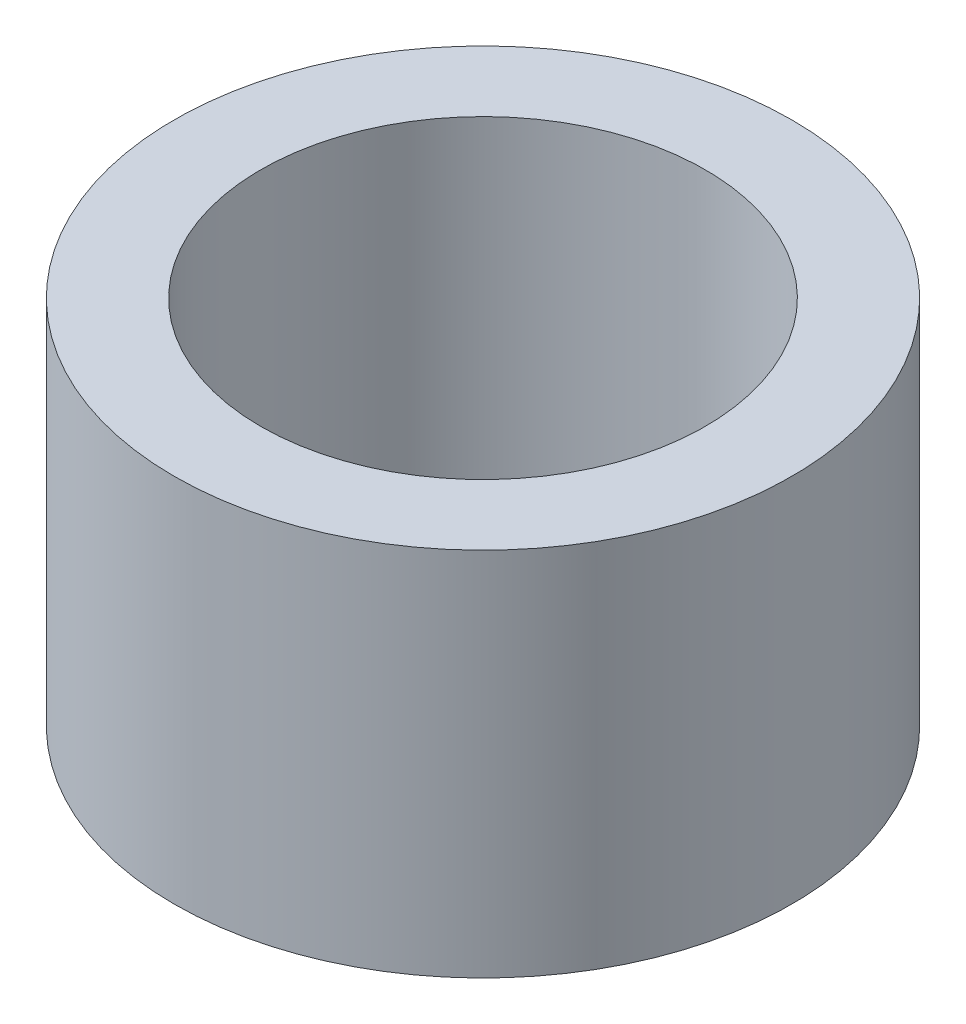
from build123d import *

# Parameters (mm, degrees)
SKETCH1_R           = 2.5
SKETCH1_R_2         = 1.8
BOSS_EXTRUDE1_DEPTH = 3


with BuildPart() as part:
    # Sketch1 → Boss-Extrude1 (new body)
    with BuildSketch(Plane(origin=(0, 0, 0), x_dir=(1, 0, 0), z_dir=(0, 1, 0))):
        with Locations(Location((0, 0, 0), (0, 0, 270))):
            Circle(SKETCH1_R)
        with Locations(Location((0, 0, 0), (0, 0, 270))):
            Circle(SKETCH1_R_2, mode=Mode.SUBTRACT)
    extrude(amount=BOSS_EXTRUDE1_DEPTH)


solid = part.part
